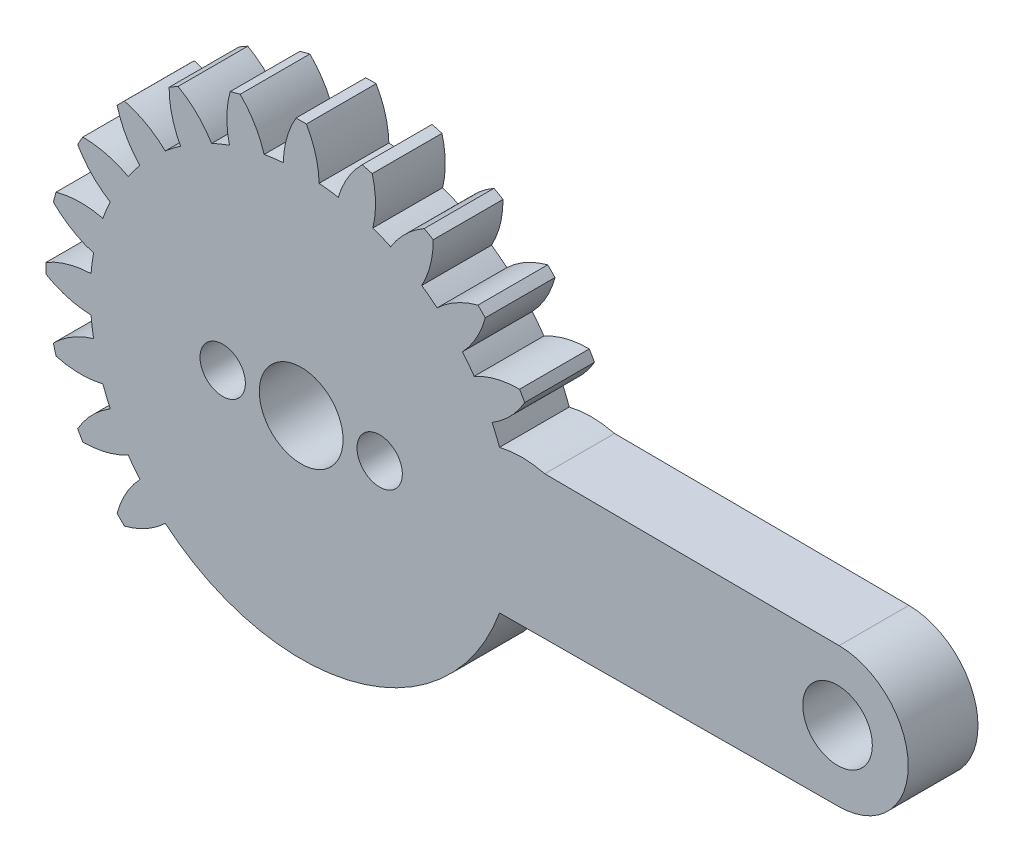
from build123d import *

# Parameters (mm, degrees)
SKETCH1_R           = 12.09
SKETCH1_R_2         = 1.75
SKETCH1_R_3         = 1.995
BOSS_EXTRUDE1_DEPTH = 4
SKETCH2_R           = 1.3
SKETCH2_R_2         = 2.4
CUT_EXTRUDE1_DEPTH  = 38.96437919


with BuildPart() as part:
    # Sketch1 → Boss-Extrude1 (new body)
    # profile 1 of 22: a face of its own
    with BuildSketch(Plane.XY):
        Circle(SKETCH1_R)
        Circle(SKETCH1_R_2, mode=Mode.SUBTRACT)
    # profile 2 of 22: a face of its own
    with BuildSketch(Plane.XY):
        with BuildLine():
            ThreePointArc((14.051469909, -4.073462091), (14.048317136, -4.084321933), (14.04515597, -4.095179336))
            Line((14.04515597, -4.095179336), (30.82582707, -3.999919373))
            ThreePointArc((30.82582707, -3.999919373), (34.803112279, -0.008027822), (30.841914591, 3.999828048))
            Line((30.841914591, 3.999828048), (14.04515597, 4.095179336))
            ThreePointArc((14.04515597, 4.095179336), (14.128586435, 3.797360314), (14.205702589, 3.497844187))
            ThreePointArc((14.205702589, 3.497844187), (14.50484412, 1.909554151), (14.626965513, 0.297959519))
            ThreePointArc((14.626965513, 0.297959519), (14.629241359, 0.148987485), (14.63, 0))
            ThreePointArc((14.63, 0), (14.629241116, -0.149011314), (14.626964543, -0.298007168))
            ThreePointArc((14.626964543, -0.298007168), (14.504858624, -1.909443973), (14.20576712, -3.497582099))
            ThreePointArc((14.20576712, -3.497582099), (14.131552306, -3.786308154), (14.051469909, -4.073462091))
        make_face()
        with Locations((30.75, 0)):
            Circle(SKETCH1_R_3, mode=Mode.SUBTRACT)
    # profile 3 of 22: a face of its own
    with BuildSketch(Plane.XY):
        with BuildLine():
            ThreePointArc((14.205702589, 3.497844187), (14.128586435, 3.797360314), (14.04515597, 4.095179336))
            Line((14.04515597, 4.095179336), (13.966164937, 4.095627749))
            Line((13.966164937, 4.095627749), (11.369827915, 4.11036655))
            ThreePointArc((11.369827915, 4.11036655), (11.678097516, 3.128919686), (11.901816808, 2.124819208))
            ThreePointArc((11.901816808, 2.124819208), (13.1403578, 2.666023245), (14.205702589, 3.497844187))
        make_face()
    # profile 4 of 22: a face of its own
    with BuildSketch(Plane.XY):
        with BuildLine():
            ThreePointArc((-12.517636695, -7.572692492), (-11.175984377, -7.407777173), (-9.917325106, -6.914821961))
            ThreePointArc((-9.917325106, -6.914821961), (-10.469253219, -6.046721181), (-10.945386333, -5.134843524))
            ThreePointArc((-10.945386333, -5.134843524), (-12.001489862, -5.978375477), (-12.815033037, -7.057749518))
            ThreePointArc((-12.815033037, -7.057749518), (-12.668951436, -7.31673216), (-12.517636695, -7.572692492))
        make_face()
    # profile 5 of 22: a face of its own
    with BuildSketch(Plane.XY):
        with BuildLine():
            ThreePointArc((-14.051145033, -4.074582586), (-12.712516328, -4.262616236), (-11.369129658, -4.112297512))
            ThreePointArc((-11.369129658, -4.112297512), (-11.677558471, -3.130930876), (-11.901445615, -2.126897335))
            ThreePointArc((-11.901445615, -2.126897335), (-13.139881298, -2.668425004), (-14.205038564, -3.500539874))
            ThreePointArc((-14.205038564, -3.500539874), (-14.13100701, -3.788342761), (-14.051145033, -4.074582586))
        make_face()
    # profile 6 of 22: a face of its own
    with BuildSketch(Plane.XY):
        with BuildLine():
            ThreePointArc((-14.626950262, -0.298707293), (-13.382615157, -0.826868574), (-12.046093246, -1.029435529))
            ThreePointArc((-12.046093246, -1.029435529), (-12.089999882, -0.001686428), (-12.046379968, 1.026074882))
            ThreePointArc((-12.046379968, 1.026074882), (-13.382791491, 0.823465153), (-14.62701917, 0.295313712))
            ThreePointArc((-14.62701917, 0.295313712), (-14.629999902, -0.00169714), (-14.626950262, -0.298707293))
        make_face()
    # profile 7 of 22: a face of its own
    with BuildSketch(Plane.XY):
        with BuildLine():
            ThreePointArc((-14.205774364, 3.497552675), (-13.140565234, 2.66528054), (-11.902026335, 2.123645243))
            ThreePointArc((-11.902026335, 2.123645243), (-11.678416405, 3.127729251), (-11.370260409, 4.109170017))
            ThreePointArc((-11.370260409, 4.109170017), (-12.71360248, 4.259309779), (-14.052145793, 4.071129894))
            ThreePointArc((-14.052145793, 4.071129894), (-14.131870386, 3.78512079), (-14.205774364, 3.497552675))
        make_face()
    # profile 8 of 22: a face of its own
    with BuildSketch(Plane.XY):
        with BuildLine():
            ThreePointArc((-9.919135011, 6.912225448), (-11.177872267, 7.404913556), (-12.519533027, 7.569556974))
            ThreePointArc((-12.519533027, 7.569556974), (-12.670533379, 7.313992337), (-12.816317544, 7.055416686))
            ThreePointArc((-12.816317544, 7.055416686), (-12.00284137, 5.975783406), (-10.94671211, 5.132016561))
            ThreePointArc((-10.94671211, 5.132016561), (-10.470825179, 6.043998682), (-9.919135011, 6.912225448))
        make_face()
    # profile 9 of 22: a face of its own
    with BuildSketch(Plane.XY):
        with BuildLine():
            ThreePointArc((-7.791898403, 9.244155952), (-8.880242473, 10.045843984), (-10.13359017, 10.552120653))
            ThreePointArc((-10.13359017, 10.552120653), (-10.345575707, 10.344368676), (-10.553302948, 10.1323589))
            ThreePointArc((-10.553302948, 10.1323589), (-10.04699158, 8.878969486), (-9.245249077, 7.790601357))
            ThreePointArc((-9.245249077, 7.790601357), (-8.549520677, 8.54832125), (-7.791898403, 9.244155952))
        make_face()
    # profile 10 of 22: a face of its own
    with BuildSketch(Plane.XY):
        with BuildLine():
            ThreePointArc((-5.133551517, 10.945992364), (-5.977311447, 12.002061971), (-7.05691548, 12.815492339))
            ThreePointArc((-7.05691548, 12.815492339), (-7.315469666, 12.669680484), (-7.571012334, 12.518652972))
            ThreePointArc((-7.571012334, 12.518652972), (-7.40634855, 11.176941958), (-6.913615931, 9.918165897))
            ThreePointArc((-6.913615931, 9.918165897), (-6.045466706, 10.469977665), (-5.133551517, 10.945992364))
        make_face()
    # profile 11 of 22: a face of its own
    with BuildSketch(Plane.XY):
        with BuildLine():
            ThreePointArc((-2.125311093, 11.901728982), (-2.666957342, 13.14020836), (-3.499215334, 14.205364904))
            ThreePointArc((-3.499215334, 14.205364904), (-3.786765286, 14.131429817), (-4.072755654, 14.051674682))
            ThreePointArc((-4.072755654, 14.051674682), (-4.260931239, 12.713077321), (-4.110760617, 11.369685446))
            ThreePointArc((-4.110760617, 11.369685446), (-3.129363382, 11.677978627), (-2.125311093, 11.901728982))
        make_face()
    # profile 12 of 22: a face of its own
    with BuildSketch(Plane.XY):
        with BuildLine():
            ThreePointArc((1.027754616, 12.046236775), (0.825159863, 13.382704508), (0.296996585, 14.626985097))
            ThreePointArc((0.296996585, 14.626985097), (0, 14.63), (-0.296996585, 14.626985097))
            ThreePointArc((-0.296996585, 14.626985097), (-0.825159863, 13.382704508), (-1.027754616, 12.046236775))
            ThreePointArc((-1.027754616, 12.046236775), (0, 12.09), (1.027754616, 12.046236775))
        make_face()
    # profile 13 of 22: a face of its own
    with BuildSketch(Plane.XY):
        with BuildLine():
            ThreePointArc((4.110717434, 11.369701059), (4.260994095, 12.713043392), (4.072942889, 14.051620413))
            ThreePointArc((4.072942889, 14.051620413), (3.786710214, 14.131444574), (3.498915331, 14.2054388))
            ThreePointArc((3.498915331, 14.2054388), (2.666773966, 13.14023428), (2.125244746, 11.901740829))
            ThreePointArc((2.125244746, 11.901740829), (3.129308654, 11.677993293), (4.110717434, 11.369701059))
        make_face()
    # profile 14 of 22: a face of its own
    with BuildSketch(Plane.XY):
        with BuildLine():
            ThreePointArc((6.913450185, 9.91828143), (7.406352802, 11.176909529), (7.571236986, 12.518517105))
            ThreePointArc((7.571236986, 12.518517105), (7.315275528, 12.669792577), (7.056292749, 12.81583523))
            ThreePointArc((7.056292749, 12.81583523), (5.976880257, 12.002254067), (5.133331053, 10.946095756))
            ThreePointArc((5.133331053, 10.946095756), (6.045273784, 10.470089058), (6.913450185, 9.91828143))
        make_face()
    # profile 15 of 22: a face of its own
    with BuildSketch(Plane.XY):
        with BuildLine():
            ThreePointArc((9.244954117, 7.790951378), (10.046869152, 8.879052728), (10.553440202, 10.132215942))
            ThreePointArc((10.553440202, 10.132215942), (10.345229175, 10.344715236), (10.132740224, 10.552936821))
            ThreePointArc((10.132740224, 10.552936821), (8.879594749, 10.046380548), (7.791503622, 9.244488699))
            ThreePointArc((7.791503622, 9.244488699), (8.549176321, 8.548665641), (9.244954117, 7.790951378))
        make_face()
    # profile 16 of 22: a face of its own
    with BuildSketch(Plane.XY):
        with BuildLine():
            ThreePointArc((10.946374382, 5.132736881), (12.002615026, 5.976132183), (12.81632055, 7.055411226))
            ThreePointArc((12.81632055, 7.055411226), (12.670115094, 7.314716911), (12.518663963, 7.570994161))
            ThreePointArc((12.518663963, 7.570994161), (11.17714698, 7.405952739), (9.918639175, 6.912936924))
            ThreePointArc((9.918639175, 6.912936924), (10.47040953, 6.044718709), (10.946374382, 5.132736881))
        make_face()
    # profile 17 of 22: a face of its own
    with BuildSketch(Plane.XY):
        with BuildLine():
            ThreePointArc((12.046231207, -1.027819886), (11.986581537, -1.577961676), (11.901820644, -2.124797724))
            ThreePointArc((11.901820644, -2.124797724), (13.140374441, -2.665881604), (14.20576712, -3.497582099))
            ThreePointArc((14.20576712, -3.497582099), (14.504858624, -1.909443973), (14.626964543, -0.298007168))
            ThreePointArc((14.626964543, -0.298007168), (13.382627003, -0.825679814), (12.046231207, -1.027819886))
        make_face()
    # profile 18 of 22: a face of its own
    with BuildSketch(Plane.XY):
        with BuildLine():
            ThreePointArc((11.901820644, -2.124797724), (11.67810034, -3.128909147), (11.369827915, -4.11036655))
            Line((11.369827915, -4.11036655), (13.967019497, -4.095622898))
            ThreePointArc((13.967019497, -4.095622898), (14.009289492, -4.084713176), (14.051469909, -4.073462091))
            ThreePointArc((14.051469909, -4.073462091), (14.131552306, -3.786308154), (14.20576712, -3.497582099))
            ThreePointArc((14.20576712, -3.497582099), (13.140374441, -2.665881604), (11.901820644, -2.124797724))
        make_face()
    # profile 19 of 22: a face of its own
    with BuildSketch(Plane.XY):
        with BuildLine():
            ThreePointArc((12.09, 0), (12.079052845, -0.514375696), (12.046231207, -1.027819886))
            ThreePointArc((12.046231207, -1.027819886), (13.382627003, -0.825679814), (14.626964543, -0.298007168))
            ThreePointArc((14.626964543, -0.298007168), (14.629241116, -0.149011314), (14.63, 0))
            ThreePointArc((14.63, 0), (14.629241359, 0.148987485), (14.626965513, 0.297959519))
            ThreePointArc((14.626965513, 0.297959519), (13.382629481, 0.825632028), (12.046235232, 1.027772701))
            ThreePointArc((12.046235232, 1.027772701), (12.079053853, 0.514352039), (12.09, 0))
        make_face()
    # profile 20 of 22: a face of its own
    with BuildSketch(Plane.XY):
        with BuildLine():
            ThreePointArc((11.901816808, 2.124819208), (11.986583203, 1.577949019), (12.046235232, 1.027772701))
            ThreePointArc((12.046235232, 1.027772701), (13.382629481, 0.825632028), (14.626965513, 0.297959519))
            ThreePointArc((14.626965513, 0.297959519), (14.50484412, 1.909554151), (14.205702589, 3.497844187))
            ThreePointArc((14.205702589, 3.497844187), (13.1403578, 2.666023245), (11.901816808, 2.124819208))
        make_face()
    # profile 21 of 22: a face of its own
    with BuildSketch(Plane.XY):
        with BuildLine():
            Line((11.369827915, 4.11036655), (13.966164937, 4.095627749))
            ThreePointArc((13.966164937, 4.095627749), (12.668895431, 4.261362771), (11.369827915, 4.11036655))
        make_face()
    # profile 22 of 22: a face of its own
    with BuildSketch(Plane.XY):
        with BuildLine():
            ThreePointArc((-10.130994605, -10.554612656), (-8.877796666, -10.047999865), (-7.789679206, -9.246026058))
            ThreePointArc((-7.789679206, -9.246026058), (-8.547489799, -8.550351931), (-9.243417598, -7.792774288))
            ThreePointArc((-9.243417598, -7.792774288), (-10.045261463, -8.880834456), (-10.55179143, -10.133932978))
            ThreePointArc((-10.55179143, -10.133932978), (-10.343531911, -10.346412306), (-10.130994605, -10.554612656))
        make_face()
    extrude(amount=BOSS_EXTRUDE1_DEPTH)

    # Sketch2 → Cut-Extrude1 (cut, through all)
    with BuildSketch(Plane.XY.offset(4)):
        with Locations((4.5, 0)):
            Circle(SKETCH2_R)
        with Locations((-4.5, 0)):
            Circle(SKETCH2_R)
        Circle(SKETCH2_R_2)
    extrude(amount=-CUT_EXTRUDE1_DEPTH, mode=Mode.SUBTRACT)


solid = part.part
